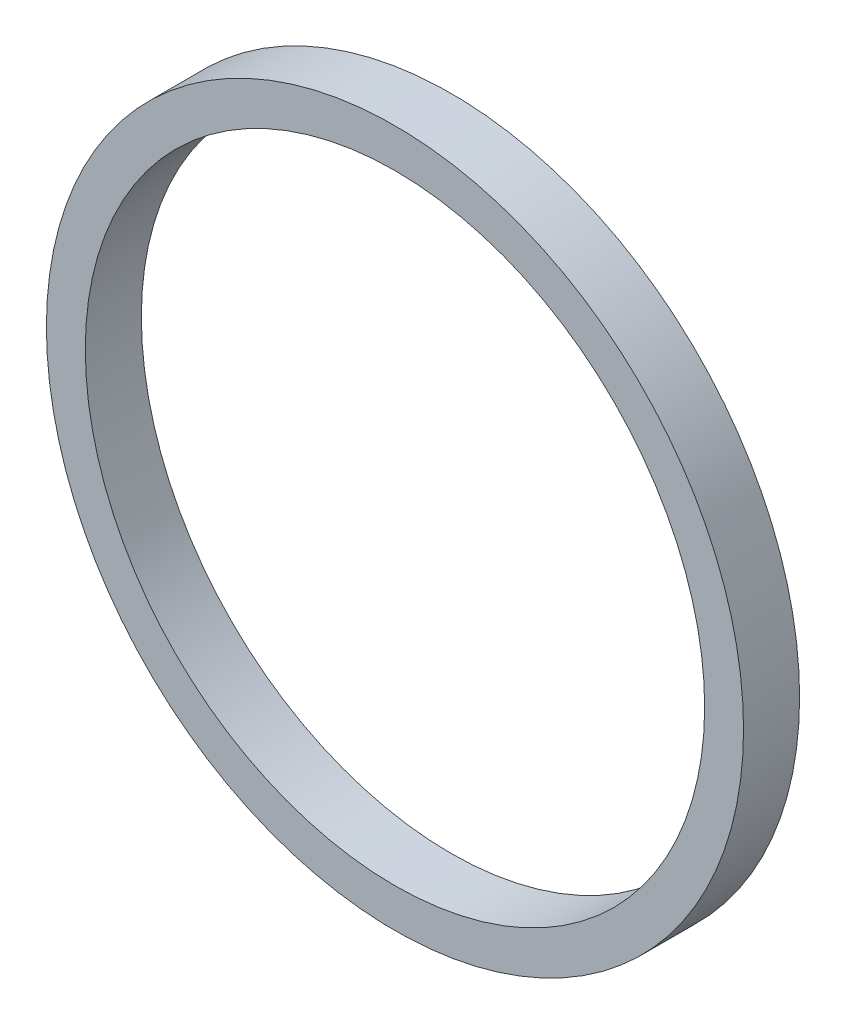
from build123d import *

# Parameters (mm, degrees)
SKETCH2_R           = 24.875
SKETCH2_R_2         = 22.1
BOSS_EXTRUDE1_DEPTH = 4


with BuildPart() as part:
    # Sketch2 → Boss-Extrude1 (new body)
    with BuildSketch(Plane.XY):
        Circle(SKETCH2_R)
        Circle(SKETCH2_R_2, mode=Mode.SUBTRACT)
    extrude(amount=BOSS_EXTRUDE1_DEPTH)


solid = part.part
